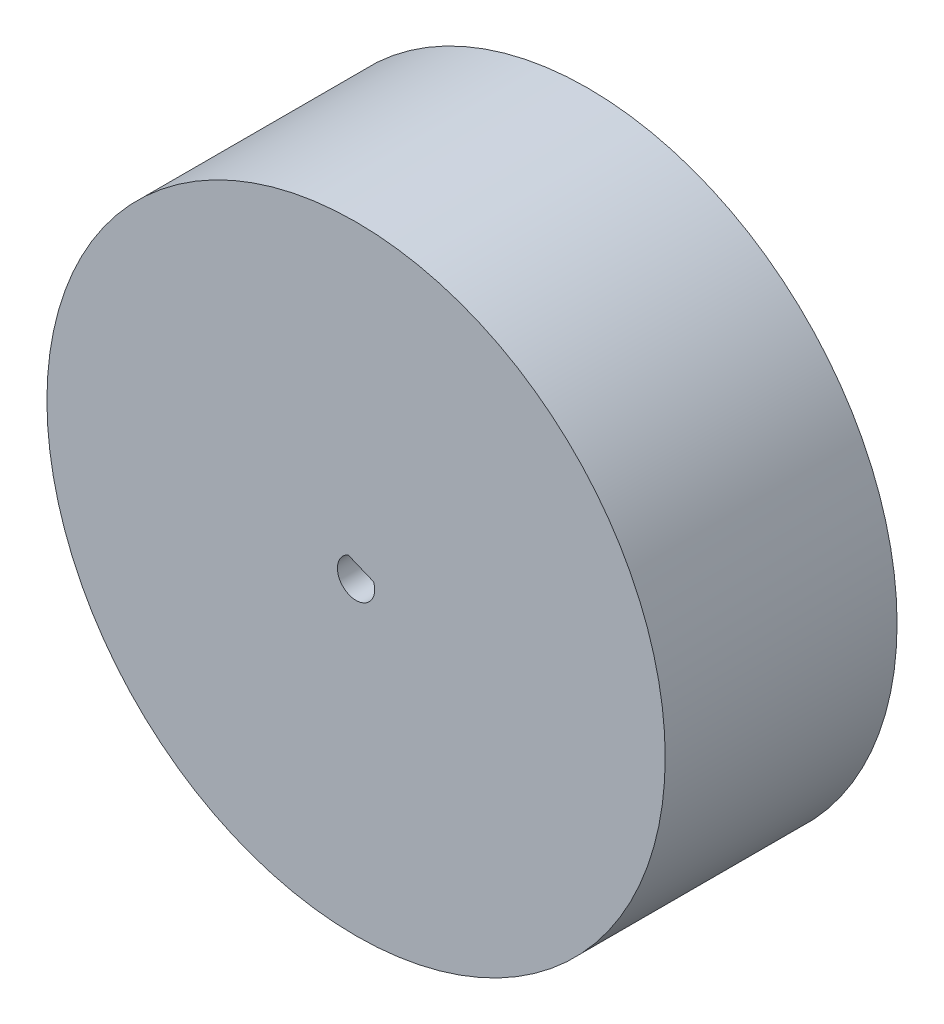
from build123d import *

# Parameters (mm, degrees)
SKETCH1_R           = 25.4
BOSS_EXTRUDE1_DEPTH = 9.525


with BuildPart() as part:
    # Sketch1 → Boss-Extrude1 (new, symmetric)
    with BuildSketch(Plane.XY):
        Circle(SKETCH1_R)
        with BuildLine():
            Line((1.439619435, 0.51806938), (1.161846601, 0.633255459))
            Line((1.161846601, 0.633255459), (-0.372765644, 1.269624265))
            Line((-0.372765644, 1.269624265), (-0.650538478, 1.384810344))
            ThreePointArc((-0.650538478, 1.384810344), (-1.106507953, 1.056664634), (-1.413303873, 0.586064982))
            ThreePointArc((-1.413303873, 0.586064982), (-0.586064982, -1.413303873), (1.413303873, -0.586064982))
            ThreePointArc((1.413303873, -0.586064982), (1.529565632, -0.036455146), (1.439619435, 0.51806938))
        make_face(mode=Mode.SUBTRACT)
    extrude(amount=BOSS_EXTRUDE1_DEPTH, both=True)


solid = part.part
